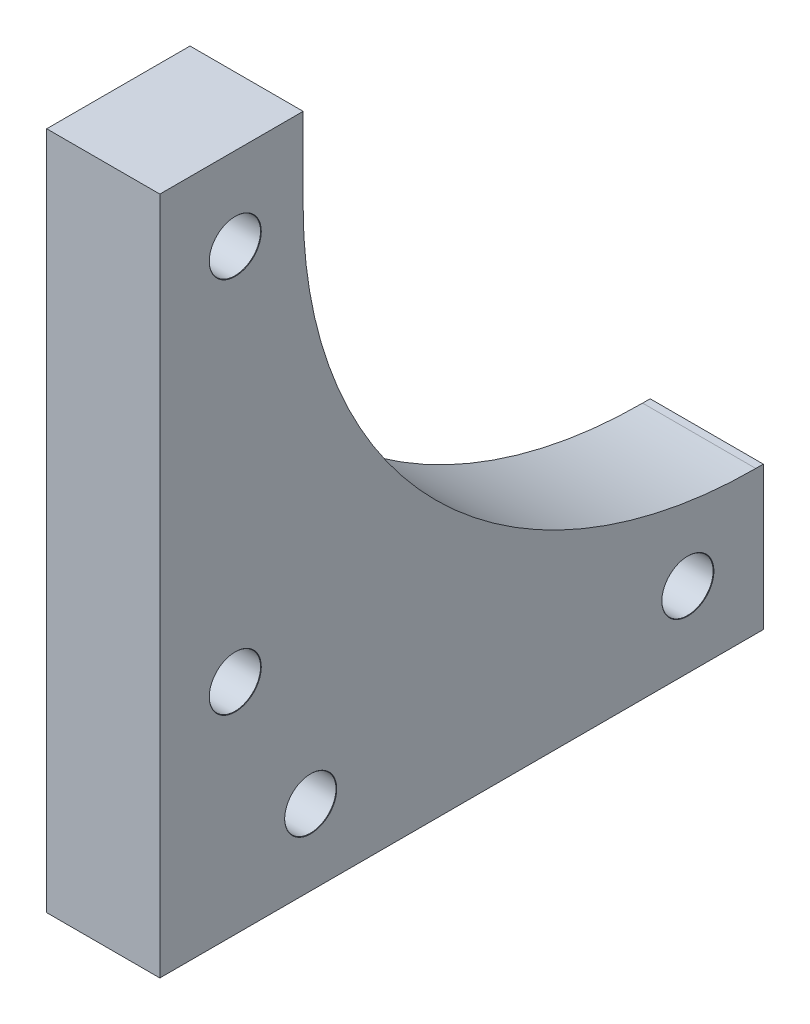
from build123d import *

# Parameters (mm, degrees)
BOSS_EXTRUDE1_DEPTH            = 7.5
M3_CLEARANCE_HOLE1_D           = 3.4
M3_CLEARANCE_HOLE1_CSINK_D     = 3.45
M3_CLEARANCE_HOLE1_CSINK_ANGLE = 90
FILLET1_R                      = 30


with BuildPart() as part:
    # Sketch1 → Boss-Extrude1 (new body)
    with BuildSketch(Plane(origin=(0, 0, 0), x_dir=(0, 0, -1), z_dir=(1, 0, 0))):
        Polygon((0, 0), (0, 45), (9.5, 45), (9.5, 9.5), (40, 9.5), (40, 0), align=None)
    extrude(amount=BOSS_EXTRUDE1_DEPTH)

    # M3 Clearance Hole1 (through all)
    with Locations(Plane(origin=(7.5, 0, 0), x_dir=(0, 0, -1), z_dir=(1, 0, 0))):
        with Locations((35, 5), (10, 5), (5, 39.5), (5, 14.5)):
            CounterSinkHole(M3_CLEARANCE_HOLE1_D / 2, M3_CLEARANCE_HOLE1_CSINK_D / 2, counter_sink_angle=M3_CLEARANCE_HOLE1_CSINK_ANGLE)

    # Fillet1
    fillet1_edges = [part.edges().sort_by_distance(p)[0] for p in [
        (3.75, 9.5, -9.5),
    ]]
    fillet(fillet1_edges, radius=FILLET1_R)


solid = part.part
